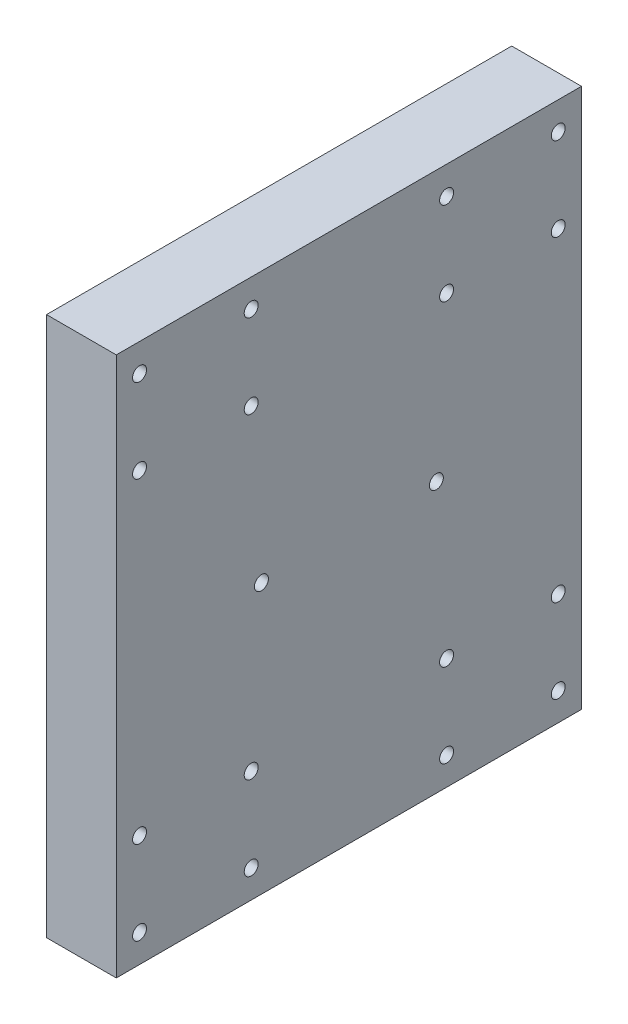
from build123d import *

# Parameters (mm, degrees)
CROQUIS1_W              = 100
CROQUIS1_H              = 116
CROQUIS1_R              = 1.5
SALIENTE_EXTRUIR1_DEPTH = 15
CROQUIS3_R              = 11
CORTAR_EXTRUIR2_DEPTH   = 7


with BuildPart() as part:
    # Croquis1 → Saliente-Extruir1 (new body)
    with BuildSketch(Plane(origin=(0, 0, 0), x_dir=(0, 0, -1), z_dir=(1, 0, 0))):
        with Locations((50, 58)):
            Rectangle(CROQUIS1_W, CROQUIS1_H)
        with Locations((5, 110)):
            Circle(CROQUIS1_R, mode=Mode.SUBTRACT)
        with Locations((29, 110)):
            Circle(CROQUIS1_R, mode=Mode.SUBTRACT)
        with Locations((5, 92)):
            Circle(CROQUIS1_R, mode=Mode.SUBTRACT)
        with Locations((29, 92)):
            Circle(CROQUIS1_R, mode=Mode.SUBTRACT)
        with Locations(Location((5, 24, 0), (0, 0, 180))):
            Circle(CROQUIS1_R, mode=Mode.SUBTRACT)
        with Locations(Location((29, 24, 0), (0, 0, 180))):
            Circle(CROQUIS1_R, mode=Mode.SUBTRACT)
        with Locations(Location((29, 6, 0), (0, 0, 180))):
            Circle(CROQUIS1_R, mode=Mode.SUBTRACT)
        with Locations(Location((5, 6, 0), (0, 0, 180))):
            Circle(CROQUIS1_R, mode=Mode.SUBTRACT)
        with Locations((31.2, 58)):
            Circle(CROQUIS1_R, mode=Mode.SUBTRACT)
        with Locations((68.8, 58)):
            Circle(CROQUIS1_R, mode=Mode.SUBTRACT)
        with Locations((71, 6)):
            Circle(CROQUIS1_R, mode=Mode.SUBTRACT)
        with Locations((95, 6)):
            Circle(CROQUIS1_R, mode=Mode.SUBTRACT)
        with Locations((95, 24)):
            Circle(CROQUIS1_R, mode=Mode.SUBTRACT)
        with Locations((71, 24)):
            Circle(CROQUIS1_R, mode=Mode.SUBTRACT)
        with Locations(Location((95, 92, 0), (0, 0, 180))):
            Circle(CROQUIS1_R, mode=Mode.SUBTRACT)
        with Locations(Location((71, 92, 0), (0, 0, 180))):
            Circle(CROQUIS1_R, mode=Mode.SUBTRACT)
        with Locations(Location((71, 110, 0), (0, 0, 180))):
            Circle(CROQUIS1_R, mode=Mode.SUBTRACT)
        with Locations(Location((95, 110, 0), (0, 0, 180))):
            Circle(CROQUIS1_R, mode=Mode.SUBTRACT)
    extrude(amount=SALIENTE_EXTRUIR1_DEPTH)

    # Croquis3 → Cortar-Extruir2 (cut)
    with BuildSketch(Plane.ZY):
        with Locations((-46.5, 99)):
            Circle(CROQUIS3_R)
        with Locations((-46.5, 17)):
            Circle(CROQUIS3_R)
    extrude(amount=-CORTAR_EXTRUIR2_DEPTH, mode=Mode.SUBTRACT)


solid = part.part
